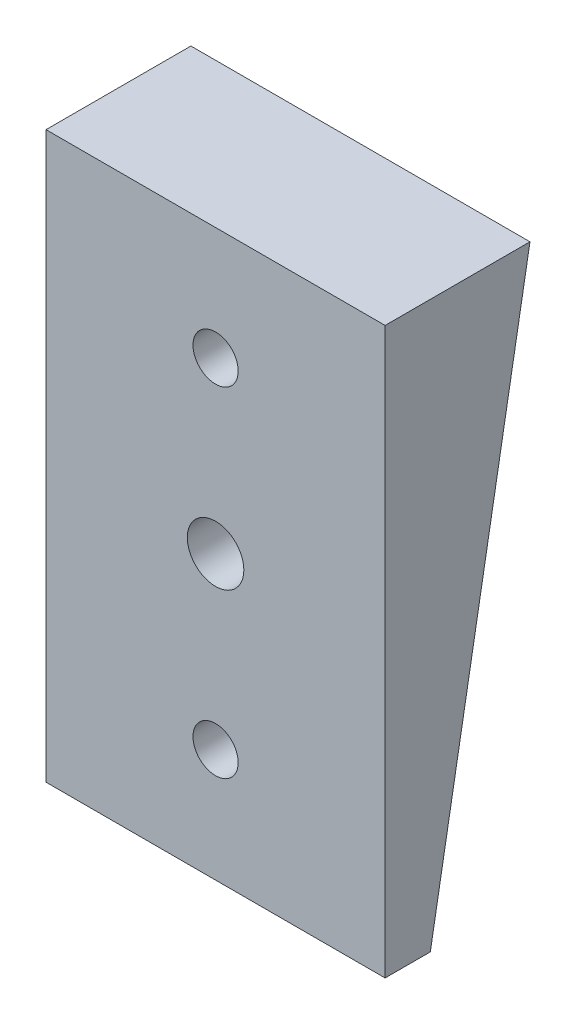
from build123d import *

# Parameters (mm, degrees)
BOSS_EXTRUDE1_DEPTH = 30
SKETCH3_R           = 4
SKETCH3_R_2         = 5
CUT_EXTRUDE1_DEPTH  = 60


with BuildPart() as part:
    # Sketch2 → Boss-Extrude1 (new, symmetric)
    with BuildSketch(Plane(origin=(0, 0, 0), x_dir=(0, 0, -1), z_dir=(1, 0, 0))):
        Polygon((4, 50), (21.632698071, 50), (4, -50), (-4, -50), (-4, 50), align=None)
    extrude(amount=BOSS_EXTRUDE1_DEPTH, both=True)

    # Sketch3 → Cut-Extrude1 (cut)
    with BuildSketch(Plane.XY.offset(4)):
        with Locations((0, -30)):
            Circle(SKETCH3_R)
        with Locations((0, 30)):
            Circle(SKETCH3_R)
        Circle(SKETCH3_R_2)
    extrude(amount=-CUT_EXTRUDE1_DEPTH, mode=Mode.SUBTRACT)


solid = part.part
